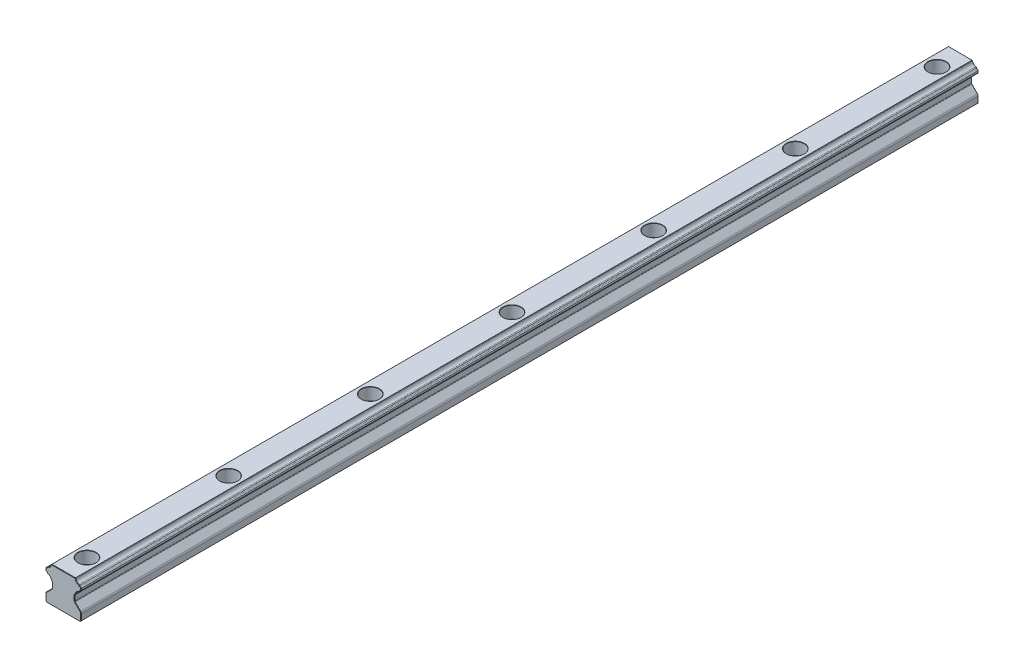
from build123d import *

# Parameters (mm, degrees)
BODY_DEPTH                                 = 380
AESTHETIC_CHAMFER_SIZE                     = 0.15
PRODUCTION_FILLET_R                        = 0.1
MOUNTING_HOLES_PATTERN_COUNT               = 4
MOUNTING_HOLES_PATTERN_PITCH               = 60
PRODUCTION_FILLET_OF_MOUNTING_HOLES_PATT_R = 0.1
MOUNTING_HOLES_PATTERN_COL_COUNT           = 4
MOUNTING_HOLES_PATTERN_COL_PITCH           = 60
PRODUCTION_FILLET_OF_MOUNTING_HOLES_2_R    = 0.1


with BuildPart() as part:
    # Rail Profile → Body (new body)
    with BuildSketch(Plane.XY):
        with BuildLine():
            Line((-7, 0), (7, 0))
            Line((7, 0), (7.5, 0.5))
            Line((7.5, 0.5), (7.5, 3.085786438))
            ThreePointArc((7.5, 3.085786438), (7.423879533, 3.46846987), (7.207106781, 3.792893219))
            Line((7.207106781, 3.792893219), (4.867157288, 6.132842712))
            ThreePointArc((4.867157288, 6.132842712), (4.780448187, 6.262612052), (4.75, 6.415685425))
            Line((4.75, 6.415685425), (4.75, 8.584314575))
            ThreePointArc((4.75, 8.584314575), (4.780448187, 8.737387948), (4.867157288, 8.867157288))
            Line((4.867157288, 8.867157288), (5.062965362, 9.062965362))
            ThreePointArc((5.062965362, 9.062965362), (5.134996734, 9.161242682), (5.17409812, 9.27664646))
            ThreePointArc((5.17409812, 9.27664646), (5.61862915, 10.13137085), (6.47335354, 10.57590188))
            ThreePointArc((6.47335354, 10.57590188), (6.694124352, 10.694306692), (6.801170165, 10.920803148))
            ThreePointArc((6.801170165, 10.920803148), (6.915305692, 11.154571658), (7.149074202, 11.268707185))
            ThreePointArc((7.149074202, 11.268707185), (7.399691242, 11.400760606), (7.5, 11.665685425))
            Line((7.5, 11.665685425), (7.5, 12.334314575))
            ThreePointArc((7.5, 12.334314575), (7.399691242, 12.599239394), (7.149074202, 12.731292815))
            ThreePointArc((7.149074202, 12.731292815), (6.915305692, 12.845428342), (6.801170165, 13.079196852))
            ThreePointArc((6.801170165, 13.079196852), (6.694124352, 13.305693308), (6.47335354, 13.42409812))
            ThreePointArc((6.47335354, 13.42409812), (5.61862915, 13.86862915), (5.17409812, 14.72335354))
            ThreePointArc((5.17409812, 14.72335354), (5.134996734, 14.838757318), (5.062965362, 14.937034638))
            Line((5.062965362, 14.937034638), (5, 15))
            Line((5, 15), (-5, 15))
            Line((-5, 15), (-5.062965362, 14.937034638))
            ThreePointArc((-5.062965362, 14.937034638), (-5.134996734, 14.838757318), (-5.17409812, 14.72335354))
            ThreePointArc((-5.17409812, 14.72335354), (-5.61862915, 13.86862915), (-6.47335354, 13.42409812))
            ThreePointArc((-6.47335354, 13.42409812), (-6.694124352, 13.305693308), (-6.801170165, 13.079196852))
            ThreePointArc((-6.801170165, 13.079196852), (-6.915305692, 12.845428342), (-7.149074202, 12.731292815))
            ThreePointArc((-7.149074202, 12.731292815), (-7.399691242, 12.599239394), (-7.5, 12.334314575))
            Line((-7.5, 12.334314575), (-7.5, 11.665685425))
            ThreePointArc((-7.5, 11.665685425), (-7.399691242, 11.400760606), (-7.149074202, 11.268707185))
            ThreePointArc((-7.149074202, 11.268707185), (-6.915305692, 11.154571658), (-6.801170165, 10.920803148))
            ThreePointArc((-6.801170165, 10.920803148), (-6.694124352, 10.694306692), (-6.47335354, 10.57590188))
            ThreePointArc((-6.47335354, 10.57590188), (-5.61862915, 10.13137085), (-5.17409812, 9.27664646))
            ThreePointArc((-5.17409812, 9.27664646), (-5.134996734, 9.161242682), (-5.062965362, 9.062965362))
            Line((-5.062965362, 9.062965362), (-4.867157288, 8.867157288))
            ThreePointArc((-4.867157288, 8.867157288), (-4.780448187, 8.737387948), (-4.75, 8.584314575))
            Line((-4.75, 8.584314575), (-4.75, 6.415685425))
            ThreePointArc((-4.75, 6.415685425), (-4.780448187, 6.262612052), (-4.867157288, 6.132842712))
            Line((-4.867157288, 6.132842712), (-7.207106781, 3.792893219))
            ThreePointArc((-7.207106781, 3.792893219), (-7.423879533, 3.46846987), (-7.5, 3.085786438))
            Line((-7.5, 3.085786438), (-7.5, 0.5))
            Line((-7.5, 0.5), (-7, 0))
        make_face()
    extrude(amount=-BODY_DEPTH)

    # Aesthetic Chamfer
    aesthetic_chamfer_edges = [part.edges().sort_by_distance(p)[0] for p in [
        (7.423879533, 3.46846987, -380),
        (-5.134996734, 9.161242682, -380),
        (-4.965061325, 8.965061325, -380),
        (-4.780448187, 8.737387948, -380),
        (-4.75, 7.5, -380),
        (-4.780448187, 6.262612052, -380),
        (-6.037132034, 4.962867966, -380),
        (-7.423879533, 3.46846987, -380),
        (-7.5, 1.792893219, -380),
        (-7.25, 0.25, -380),
        (0, 0, -380),
        (6.037132034, 4.962867966, -380),
        (4.780448187, 6.262612052, -380),
        (4.75, 7.5, -380),
        (4.780448187, 8.737387948, -380),
        (4.965061325, 8.965061325, -380),
        (5.134996734, 9.161242682, -380),
        (5.61862915, 10.13137085, -380),
        (6.694124352, 10.694306692, -380),
        (0, 0, 0),
        (-7.25, 0.25, 0),
        (-7.5, 1.792893219, 0),
        (-7.423879533, 3.46846987, 0),
        (-6.037132034, 4.962867966, 0),
        (-4.780448187, 6.262612052, 0),
        (6.915305692, 11.154571658, -380),
        (-4.75, 7.5, 0),
        (-4.780448187, 8.737387948, 0),
        (-4.965061325, 8.965061325, 0),
        (-5.134996734, 9.161242682, 0),
        (-5.61862915, 10.13137085, 0),
        (-6.694124352, 10.694306692, 0),
        (-6.915305692, 11.154571658, 0),
        (7.25, 0.25, -380),
        (7.399691242, 11.400760606, -380),
        (-7.399691242, 11.400760606, 0),
        (-7.5, 12, 0),
        (-7.399691242, 12.599239394, 0),
        (-6.915305692, 12.845428342, 0),
        (-6.694124352, 13.305693308, 0),
        (-5.61862915, 13.86862915, 0),
        (-5.134996734, 14.838757318, 0),
        (-5.031482681, 14.968517319, 0),
        (7.5, 12, -380),
        (0, 15, 0),
        (5.031482681, 14.968517319, 0),
        (5.134996734, 14.838757318, 0),
        (5.61862915, 13.86862915, 0),
        (6.694124352, 13.305693308, 0),
        (6.915305692, 12.845428342, 0),
        (7.399691242, 12.599239394, 0),
        (7.399691242, 12.599239394, -380),
        (7.5, 12, 0),
        (7.399691242, 11.400760606, 0),
        (6.915305692, 11.154571658, 0),
        (6.694124352, 10.694306692, 0),
        (5.61862915, 10.13137085, 0),
        (5.134996734, 9.161242682, 0),
        (4.965061325, 8.965061325, 0),
        (4.780448187, 8.737387948, 0),
        (6.915305692, 12.845428342, -380),
        (4.75, 7.5, 0),
        (4.780448187, 6.262612052, 0),
        (6.037132034, 4.962867966, 0),
        (7.423879533, 3.46846987, 0),
        (7.5, 1.792893219, 0),
        (7.25, 0.25, 0),
        (6.694124352, 13.305693308, -380),
        (5.61862915, 13.86862915, -380),
        (5.134996734, 14.838757318, -380),
        (5.031482681, 14.968517319, -380),
        (0, 15, -380),
        (-5.031482681, 14.968517319, -380),
        (7.5, 1.792893219, -380),
        (-5.134996734, 14.838757318, -380),
        (-5.61862915, 13.86862915, -380),
        (-6.694124352, 13.305693308, -380),
        (-6.915305692, 12.845428342, -380),
        (-7.399691242, 12.599239394, -380),
        (-7.5, 12, -380),
        (-7.399691242, 11.400760606, -380),
        (-6.915305692, 11.154571658, -380),
        (-6.694124352, 10.694306692, -380),
        (-5.61862915, 10.13137085, -380),
    ]]
    chamfer(aesthetic_chamfer_edges, length=AESTHETIC_CHAMFER_SIZE)

    # Sketch1 → Mounting Hole (revolve, cut)
    with BuildSketch(Plane(origin=(0, 15, -190), x_dir=(0, 0, 1), z_dir=(1, 0, 0))):
        Polygon((0, 0), (0, 15), (2.35, 15), (2.25, 14.9), (2.25, 5.4), (2.35, 5.3), (3.75, 5.3), (3.75, 0.1), (3.85, 0), align=None)
    mounting_hole = revolve(axis=Axis((0, 21.35, -190), (0, -1, 0)), mode=Mode.SUBTRACT)

    # Production Fillet
    production_fillet_edges = [part.edges().sort_by_distance(p)[0] for p in [
        (0, 9.7, -193.75),
    ]]
    fillet(production_fillet_edges, radius=PRODUCTION_FILLET_R)

    # Mounting Holes Pattern: Mounting Hole ×4
    with Locations(*[(0, 0, -i * MOUNTING_HOLES_PATTERN_PITCH) for i in range(1, MOUNTING_HOLES_PATTERN_COUNT)]):
        add(mounting_hole, mode=Mode.SUBTRACT)

    # Production Fillet of Mounting Holes Patt
    production_fillet_of_mounting_holes_patt_edges = [part.edges().sort_by_distance(p)[0] for p in [
        (0, 9.7, -253.75),
        (0, 9.7, -313.75),
        (0, 9.7, -373.75),
    ]]
    fillet(production_fillet_of_mounting_holes_patt_edges, radius=PRODUCTION_FILLET_OF_MOUNTING_HOLES_PATT_R)

    # Mounting Holes Pattern col: Mounting Hole ×4
    with Locations(*[(0, 0, i * MOUNTING_HOLES_PATTERN_COL_PITCH) for i in range(1, MOUNTING_HOLES_PATTERN_COL_COUNT)]):
        add(mounting_hole, mode=Mode.SUBTRACT)

    # Production Fillet of Mounting Holes  2
    production_fillet_of_mounting_holes_2_edges = [part.edges().sort_by_distance(p)[0] for p in [
        (0, 9.7, -133.75),
        (0, 9.7, -73.75),
        (0, 9.7, -13.75),
    ]]
    fillet(production_fillet_of_mounting_holes_2_edges, radius=PRODUCTION_FILLET_OF_MOUNTING_HOLES_2_R)


solid = part.part
